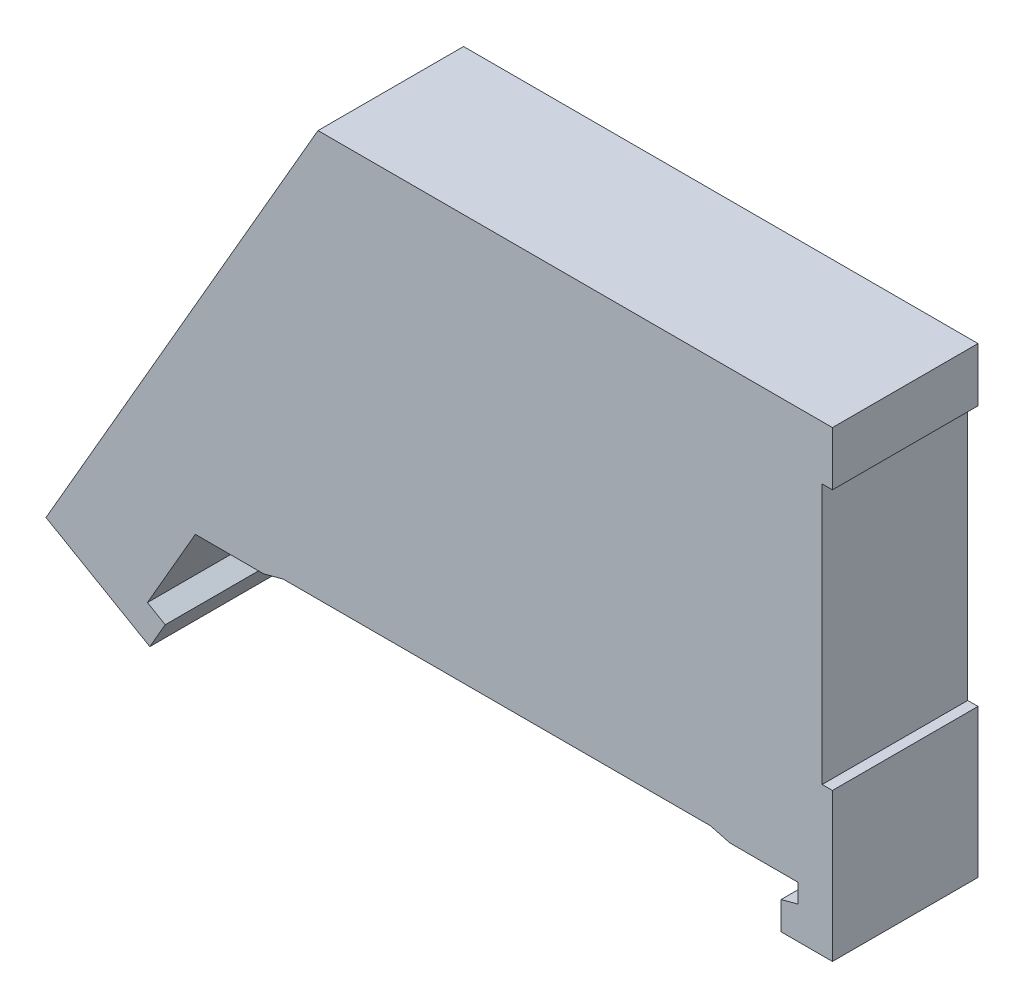
from build123d import *

# Parameters (mm, degrees)
DODANIE_WYCI_GNI_CIE1_DEPTH = 8.5


with BuildPart() as part:
    # Szkic1 → Dodanie-wyciągnięcie1 (new body)
    with BuildSketch(Plane(origin=(0, 0, 0), x_dir=(-1, 0, 0), z_dir=(0, 0, -1))):
        Polygon((-8.080384758, 0.3), (16.880384758, 0.3), (18, 0), (22, 0), (24.8, -4.849742261), (23.759936491, -5.450223208), (24.659936491, -7.009068935), (30.722114317, -3.509068935), (14.839745962, 24), (-15.2, 24), (-15.2, 20.85), (-14.6, 20.85), (-14.6, 5.65), (-15.2, 5.65), (-15.2, -3), (-12.2, -3), (-12.2, -1.367949192), (-13.2, -1.1), (-13.2, 0), (-9.2, 0), align=None)
    extrude(amount=-DODANIE_WYCI_GNI_CIE1_DEPTH)


solid = part.part
